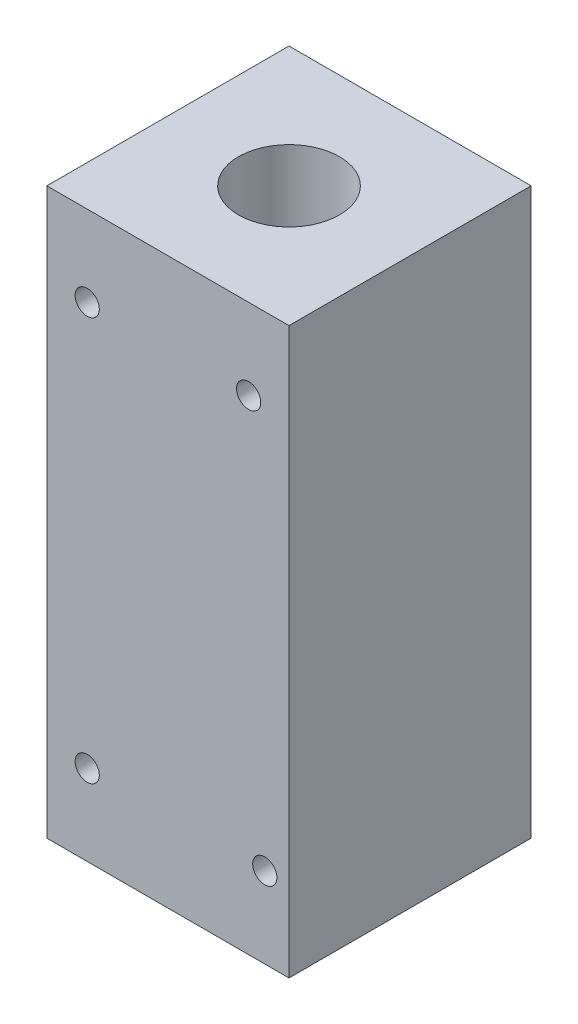
from build123d import *

# Parameters (mm, degrees)
ESBO_O1_W                = 30
ESBO_O1_H                = 70
RESSALTO_EXTRUS_O1_DEPTH = 30
ESBO_O3_R                = 6.255
CORTE_EXTRUS_O2_DEPTH    = 82.853527719
ESBO_O4_R                = 1.5
CORTE_EXTRUS_O3_DEPTH    = 82.853527719
ESBO_O5_R                = 1.5
CORTE_EXTRUS_O4_DEPTH    = 10


with BuildPart() as part:
    # Esboço1 → Ressalto-extrusão1 (new body)
    with BuildSketch(Plane.XY):
        with Locations((-15, 35)):
            Rectangle(ESBO_O1_W, ESBO_O1_H)
    extrude(amount=RESSALTO_EXTRUS_O1_DEPTH)

    # Esboço3 → Corte-extrusão2 (cut, through all)
    with BuildSketch(Plane(origin=(0, 70, 0), x_dir=(1, 0, 0), z_dir=(0, 1, 0))):
        with Locations(Location((-15, -15, 0), (0, 0, 270))):
            Circle(ESBO_O3_R)
    extrude(amount=-CORTE_EXTRUS_O2_DEPTH, mode=Mode.SUBTRACT)

    # Esboço4 → Corte-extrusão3 (cut, through all)
    with BuildSketch(Plane(origin=(0, 0, 0), x_dir=(-1, 0, 0), z_dir=(0, 0, -1))):
        with Locations((5, 60)):
            Circle(ESBO_O4_R)
        with Locations((3, 10)):
            Circle(ESBO_O4_R)
        with Locations((25, 60)):
            Circle(ESBO_O4_R)
        with Locations((25, 10)):
            Circle(ESBO_O4_R)
    extrude(amount=-CORTE_EXTRUS_O3_DEPTH, mode=Mode.SUBTRACT)

    # Esboço5 → Corte-extrusão4 (cut)
    with BuildSketch(Plane.ZY.offset(30)):
        with Locations((2.924479503, 50)):
            Circle(ESBO_O5_R)
        with Locations((2.924479503, 20)):
            Circle(ESBO_O5_R)
    extrude(amount=-CORTE_EXTRUS_O4_DEPTH, mode=Mode.SUBTRACT)


solid = part.part
